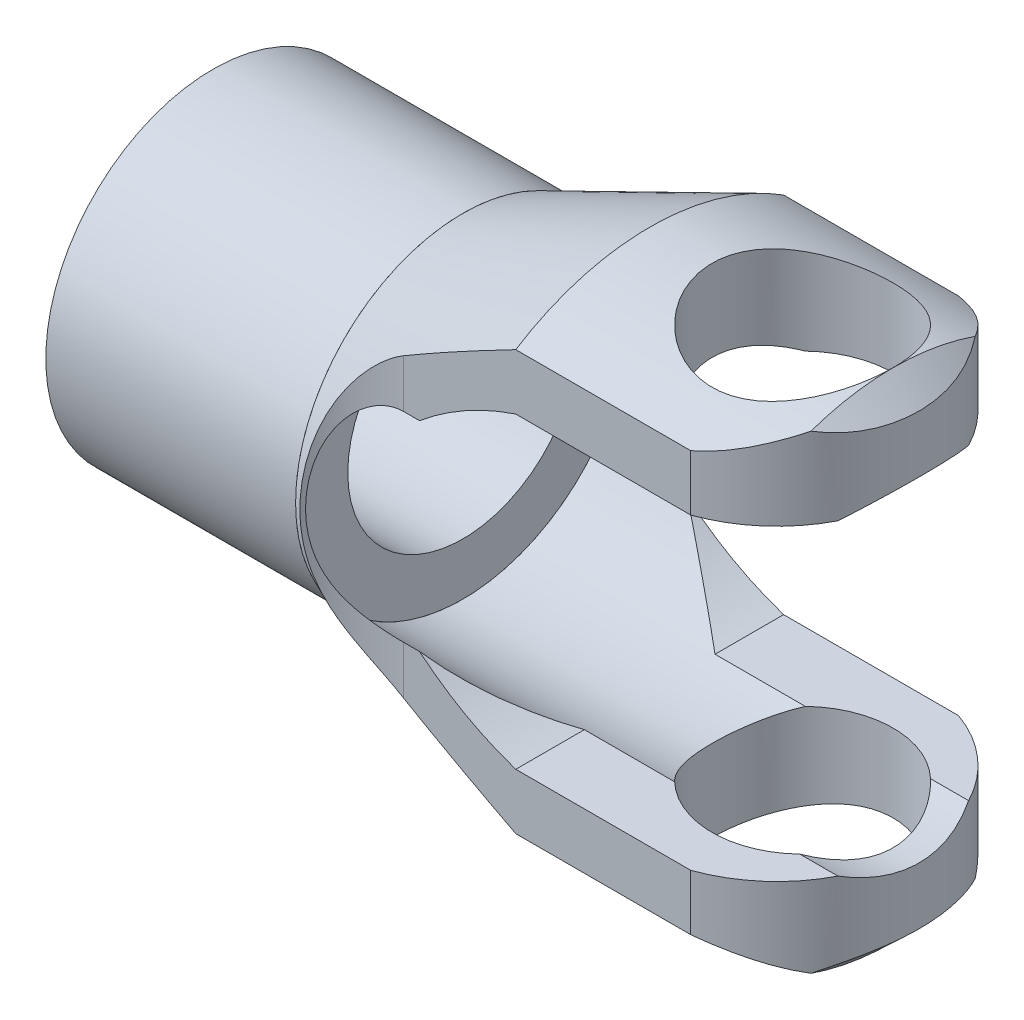
from build123d import *
from build123d.topology import SkipClean

# Parameters (mm, degrees)
SKETCH2_R               = 13.85
BOSS_EXTRUDE1_DEPTH     = 20.7
SKETCH3_R               = 9.525
CUT_EXTRUDE1_DEPTH      = 30.7
CUT_EXTRUDE2_DEPTH      = 30.7
CUT_EXTRUDE2_DEPTH_BACK = 30.7
CUT_EXTRUDE3_DEPTH      = 30.7
CUT_EXTRUDE3_DEPTH_BACK = 30.7
CUT_EXTRUDE4_DEPTH      = 33
CUT_EXTRUDE4_DEPTH_BACK = 38
SKETCH7_R               = 7.5


with BuildPart() as part:
    # Sketch2 → Boss-Extrude1 (new body)
    with BuildSketch(Plane(origin=(0, 0, 0), x_dir=(0, 0, -1), z_dir=(1, 0, 0))):
        Circle(SKETCH2_R)
    extrude(amount=BOSS_EXTRUDE1_DEPTH)

    # Sketch3 → Cut-Extrude1 (cut)
    with BuildSketch(Plane(origin=(0, 0, 0), x_dir=(0, 0, -1), z_dir=(1, 0, 0))):
        Circle(SKETCH3_R)
    extrude(amount=CUT_EXTRUDE1_DEPTH, mode=Mode.SUBTRACT)


with BuildPart() as body_2:
    # Sketch4 → Revolve1 (revolve)
    with BuildSketch(Plane.XY):
        Polygon((36.195976439, 20.612939258), (20.7, 13.85), (58.54860717, 13.85), (58.54860717, 15.033629067), (58.54860717, 18.562761704), (56.3664984, 20.612939258), align=None)
    revolve(axis=Axis((0, 0, 0), (1, 0, 0)))

    # Sketch5 → Cut-Extrude2 (cut, two sides: drawn at the far end of the back side and taken through both)
    with BuildSketch(Plane.XY.offset(-CUT_EXTRUDE2_DEPTH_BACK)):
        with BuildLine():
            Line((67.664130328, 12.747761704), (58.54860717, 12.747761704))
            Line((58.54860717, 12.747761704), (36.195976439, 12.747761704))
            ThreePointArc((36.195976439, 12.747761704), (30.495678195, 9.977581571), (25.7, 5.834060282))
            Line((25.7, 5.834060282), (25.7, 0))
            Line((25.7, 0), (25.7, -5.834060282))
            ThreePointArc((25.7, -5.834060282), (30.495678195, -9.977581571), (36.195976439, -12.747761704))
            Line((36.195976439, -12.747761704), (58.54860717, -12.747761704))
            Line((58.54860717, -12.747761704), (67.664130328, -13.21427262))
            Line((67.664130328, -13.21427262), (67.664130328, 12.747761704))
        make_face()
    extrude(amount=CUT_EXTRUDE2_DEPTH + CUT_EXTRUDE2_DEPTH_BACK, mode=Mode.SUBTRACT)

    # Sketch6 → Cut-Extrude3 (cut, two sides: drawn at the far end of the back side and taken through both)
    with BuildSketch(Plane(origin=(0, 0, 0), x_dir=(1, 0, 0), z_dir=(0, 1, 0)).offset(-CUT_EXTRUDE3_DEPTH_BACK)):
        with BuildLine():
            Line((50.695976439, -11.099019327), (36.195976439, -11.099019327))
            Line((36.195976439, -11.099019327), (26.899786184, -11.099019327))
            ThreePointArc((26.899786184, -11.099019327), (23.731359262, -11.904737016), (21.332715776, -14.126137382))
            Line((21.332715776, -14.126137382), (22.970904699, -18.194593221))
            Line((22.970904699, -18.194593221), (60.986199316, -21.500271014))
            Line((60.986199316, -21.500271014), (77.664846362, -14.888915428))
            Line((77.664846362, -14.888915428), (78.566394851, 21.323282212))
            Line((78.566394851, 21.323282212), (20.11600115, 21.323282212))
            Line((20.11600115, 21.323282212), (21.332715776, 14.126137382))
            ThreePointArc((21.332715776, 14.126137382), (23.731359262, 11.904737016), (26.899786184, 11.099019327))
            Line((26.899786184, 11.099019327), (36.195976439, 11.099019327))
            Line((36.195976439, 11.099019327), (50.695976439, 11.099019327))
            ThreePointArc((50.695976439, 11.099019327), (58.530570716, 0), (50.695976439, -11.099019327))
        make_face()
    extrude(amount=CUT_EXTRUDE3_DEPTH + CUT_EXTRUDE3_DEPTH_BACK, mode=Mode.SUBTRACT)

    # Sketch7 → Cut-Extrude4 (cut, two sides: drawn at the far end of the back side and taken through both)
    with SkipClean():  # the faces are left unmerged after this step: merging them gives an invalid solid
        with BuildSketch(Plane(origin=(0, 0, 0), x_dir=(1, 0, 0), z_dir=(0, 1, 0)).offset(-CUT_EXTRUDE4_DEPTH_BACK)):
            with Locations((48.8664984, 0)):
                Circle(SKETCH7_R)
        extrude(amount=CUT_EXTRUDE4_DEPTH + CUT_EXTRUDE4_DEPTH_BACK, mode=Mode.SUBTRACT)


solid = Compound([part.part, body_2.part])
